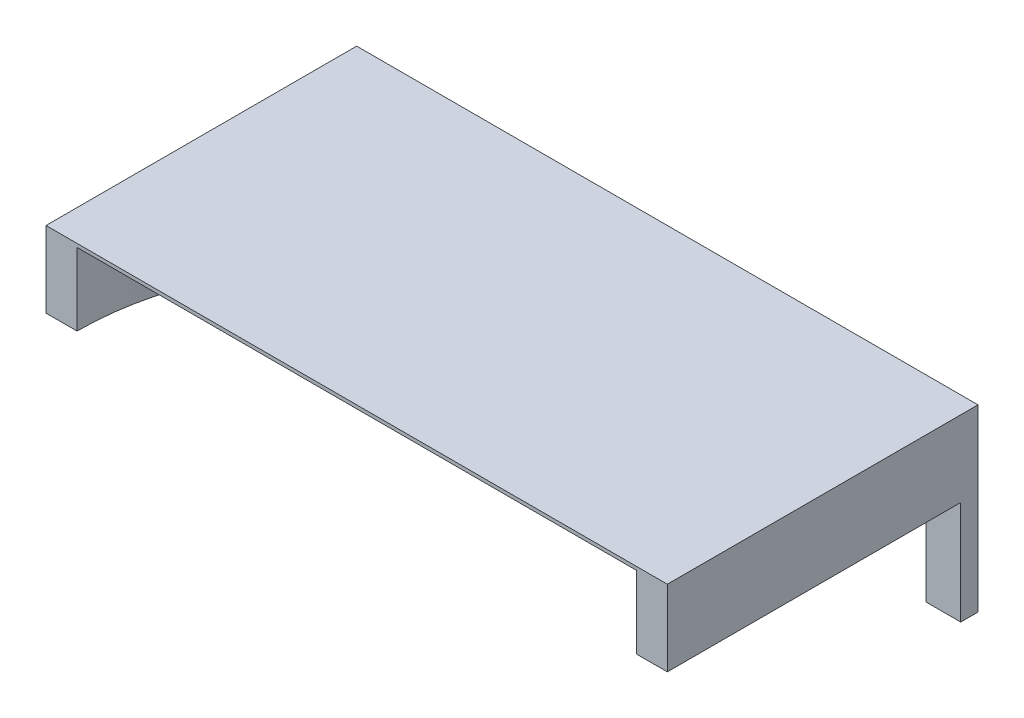
from build123d import *

# Parameters (mm, degrees)
EXTRUDE_1_DEPTH = 22
SKETCH_2_W      = 180
SKETCH_2_H      = 90
EXTRUDE_2_DEPTH = 1
SKETCH_3_W      = 10
SKETCH_3_H      = 5
EXTRUDE_3_DEPTH = 30
FILLET_1_R      = 10


with BuildPart() as part:
    # Эскиз1 → Бобышка-Вытянуть1 (new body)
    with BuildSketch(Plane(origin=(0, 0, 0), x_dir=(-1, 0, 0), z_dir=(0, 1, 0))):
        with BuildLine():
            Line((-90, 0), (90, 0))
            Line((90, 0), (90, 90))
            Line((90, 90), (81, 90))
            ThreePointArc((81, 90), (0, 9), (-81, 90))
            Line((-81, 90), (-90, 90))
            Line((-90, 90), (-90, 0))
        make_face()
    extrude(amount=EXTRUDE_1_DEPTH)

    # Эскиз2 → Бобышка-Вытянуть2 (add)
    with BuildSketch(Plane(origin=(0, 22, 0), x_dir=(1, 0, 0), z_dir=(0, 1, 0))):
        with Locations((0, -45)):
            Rectangle(SKETCH_2_W, SKETCH_2_H)
    extrude(amount=-EXTRUDE_2_DEPTH)

    # Эскиз3 → Бобышка-Вытянуть3 (add)
    with BuildSketch(Plane.XZ):
        with Locations((-85, 2.5)):
            Rectangle(SKETCH_3_W, SKETCH_3_H)
        with Locations((85, 2.5)):
            Rectangle(SKETCH_3_W, SKETCH_3_H)
    extrude(amount=EXTRUDE_3_DEPTH)

    # Скругление1
    fillet_1_edges = [part.edges().sort_by_distance(p)[0] for p in [
        (-80, 0, 2.5),
        (80, 0, 2.5),
    ]]
    fillet(fillet_1_edges, radius=FILLET_1_R)


solid = part.part
